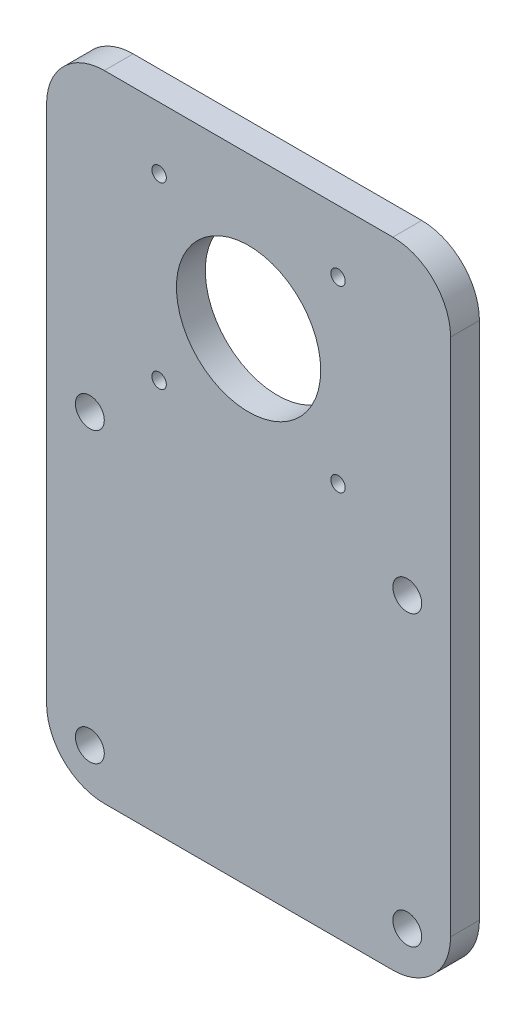
from build123d import *

# Parameters (mm, degrees)
SKETCH1_W           = 70
SKETCH1_H           = 110
SKETCH1_R           = 2.5
SKETCH1_R_2         = 12.5
SKETCH1_R_3         = 1.25
BOSS_EXTRUDE1_DEPTH = 5
FILLET1_R           = 10


with BuildPart() as part:
    # Sketch1 → Boss-Extrude1 (new body)
    with BuildSketch(Plane.XY):
        with Locations((-21.007524629, -22.344146878)):
            Rectangle(SKETCH1_W, SKETCH1_H)
        with Locations((-48.507524629, -19.844146878)):
            Circle(SKETCH1_R, mode=Mode.SUBTRACT)
        with Locations((6.492475371, -19.844146878)):
            Circle(SKETCH1_R, mode=Mode.SUBTRACT)
        with Locations((-48.507524629, -69.844146878)):
            Circle(SKETCH1_R, mode=Mode.SUBTRACT)
        with Locations((6.492475371, -69.844146878)):
            Circle(SKETCH1_R, mode=Mode.SUBTRACT)
        with Locations((-21.007524629, 6.405853122)):
            Circle(SKETCH1_R_2, mode=Mode.SUBTRACT)
        with Locations((-36.507524629, 21.908578371)):
            Circle(SKETCH1_R_3, mode=Mode.SUBTRACT)
        with Locations((-5.507524629, 21.903128352)):
            Circle(SKETCH1_R_3, mode=Mode.SUBTRACT)
        with Locations((-5.507524629, -9.096872127)):
            Circle(SKETCH1_R_3, mode=Mode.SUBTRACT)
        with Locations((-36.507524629, -9.091422108)):
            Circle(SKETCH1_R_3, mode=Mode.SUBTRACT)
    extrude(amount=BOSS_EXTRUDE1_DEPTH)

    # Fillet1
    fillet1_edges = [part.edges().sort_by_distance(p)[0] for p in [
        (-56.007524629, 32.655853122, 2.5),
        (13.992475371, 32.655853122, 2.5),
        (13.992475371, -77.344146878, 2.5),
        (-56.007524629, -77.344146878, 2.5),
    ]]
    fillet(fillet1_edges, radius=FILLET1_R)


solid = part.part
